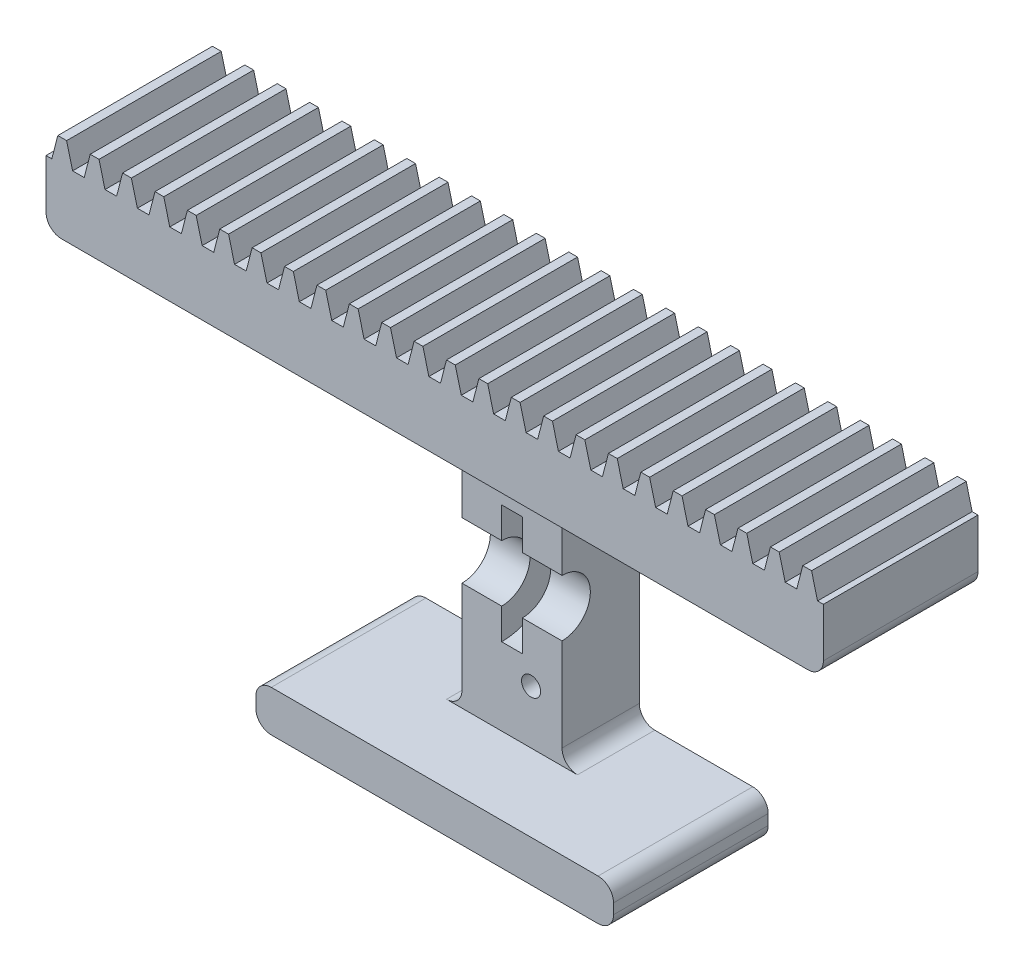
from build123d import *

# Parameters (mm, degrees)
RESSALTO_EXTRUS_O1_DEPTH          = 30
RESSALTO_EXTRUS_O2_DEPTH          = 30
ESBO_O3_W                         = 19.4
ESBO_O3_H                         = 3.2
CORTE_EXTRUS_O1_DEPTH             = 23.85
ESBO_O4_W                         = 5.4
ESBO_O4_H                         = 23.8
CORTE_EXTRUS_O2_DEPTH             = 26.5
ESBO_O5_W                         = 19.4
ESBO_O5_H                         = 53
CORTE_EXTRUS_O3_DEPTH             = 15.6
FILETE1_R                         = 5
ESBO_O6_W                         = 69.4
ESBO_O6_H                         = 15.6
CORTE_EXTRUS_O4_DEPTH             = 10
FILETE2_R                         = 3
RESSALTO_EXTRUS_O3_START          = 15.6
RESSALTO_EXTRUS_O3_DEPTH          = 15.6
ESBO_O8_R                         = 1.85
CORTE_EXTRUS_O5_DEPTH             = 165.173688513
CORTE_EXTRUS_O6_DEPTH             = 4
ESBO_O10_W                        = 14.4
ESBO_O10_H                        = 28.961678943
RESSALTO_EXTRUS_O4_DEPTH          = 19.4
RESSALTO_EXTRUS_O5_START          = 15.6
ESBO_O11_R                        = 1.85
RESSALTO_EXTRUS_O5_DEPTH          = 15.6
ESBO_O12_W                        = 35.911027454
ESBO_O12_H                        = 55
CORTE_EXTRUS_O7_DEPTH             = 15
CORTE_EXTRUS_O8_DEPTH             = 2
CORTE_EXTRUS_O8_DEPTH_BACK        = 2
ESBO_O13_R                        = 11.5
CORTE_EXTRUS_O9_REACH             = 104.733
ESBO_O14_R                        = 5.5
CORTE_EXTRUS_O9_DIRECTION_2_REACH = 104.733
CORTE_EXTRUS_O10_DEPTH            = 4


with BuildPart() as part:
    # Esboço1 → Ressalto-extrusão1 (new body)
    with BuildSketch(Plane.XY):
        Polygon((-148.507415706, 17), (-149.671194836, 12.5), (-150.8, 12.5), (-150.8, 0), (0, 0), (0, 12.5), (-1.125252364, 12.5), (-2.289031494, 17), (-3.994153806, 17), (-5.157932936, 12.5), (-7.408437664, 12.5), (-8.572216794, 17), (-10.277339106, 17), (-11.441118236, 12.5), (-13.691622964, 12.5), (-14.855402094, 17), (-16.560524406, 17), (-17.724303536, 12.5), (-19.974808264, 12.5), (-21.138587394, 17), (-22.843709706, 17), (-24.007488836, 12.5), (-26.257993564, 12.5), (-27.421772694, 17), (-29.126895006, 17), (-30.290674136, 12.5), (-32.541178864, 12.5), (-33.704957994, 17), (-35.410080306, 17), (-36.573859436, 12.5), (-38.824364164, 12.5), (-39.988143294, 17), (-41.693265606, 17), (-42.857044736, 12.5), (-45.107549464, 12.5), (-46.271328594, 17), (-47.976450906, 17), (-49.140230036, 12.5), (-51.390734764, 12.5), (-52.554513894, 17), (-54.259636206, 17), (-55.423415336, 12.5), (-57.673920064, 12.5), (-58.837699194, 17), (-60.542821506, 17), (-61.706600636, 12.5), (-63.957105364, 12.5), (-65.120884494, 17), (-66.826006806, 17), (-67.989785936, 12.5), (-70.240290664, 12.5), (-71.404069794, 17), (-73.109192106, 17), (-74.272971236, 12.5), (-76.523475964, 12.5), (-77.687255094, 17), (-79.392377406, 17), (-80.556156536, 12.5), (-82.806661264, 12.5), (-83.970440394, 17), (-85.675562706, 17), (-86.839341836, 12.5), (-89.089846564, 12.5), (-90.253625694, 17), (-91.958748006, 17), (-93.122527136, 12.5), (-95.373031864, 12.5), (-96.536810994, 17), (-98.241933306, 17), (-99.405712436, 12.5), (-101.656217164, 12.5), (-102.819996294, 17), (-104.525118606, 17), (-105.688897736, 12.5), (-107.939402464, 12.5), (-109.103181594, 17), (-110.808303906, 17), (-111.972083036, 12.5), (-114.222587764, 12.5), (-115.386366894, 17), (-117.091489206, 17), (-118.255268336, 12.5), (-120.505773064, 12.5), (-121.669552194, 17), (-123.374674506, 17), (-124.538453636, 12.5), (-126.788958364, 12.5), (-127.952737494, 17), (-129.657859806, 17), (-130.821638936, 12.5), (-133.072143664, 12.5), (-134.235922794, 17), (-135.941045106, 17), (-137.104824236, 12.5), (-139.355328964, 12.5), (-140.519108094, 17), (-142.224230406, 17), (-143.388009536, 12.5), (-145.638514264, 12.5), (-146.802293394, 17), align=None)
    extrude(amount=-RESSALTO_EXTRUS_O1_DEPTH)

    # Esboço2 → Ressalto-extrusão2 (add)
    with BuildSketch(Plane(origin=(0, 0, -30), x_dir=(-1, 0, 0), z_dir=(0, 0, -1))):
        Polygon((85.1, 0), (65.7, 0), (65.7, -55), (40.7, -55), (40.7, -63), (110.1, -63), (110.1, -55), (85.1, -55), align=None)
    extrude(amount=-RESSALTO_EXTRUS_O2_DEPTH)

    # Esboço3 → Corte-extrusão1 (cut)
    with BuildSketch(Plane.XY):
        with Locations((-75.4, -29)):
            Rectangle(ESBO_O3_W, ESBO_O3_H)
    extrude(amount=-CORTE_EXTRUS_O1_DEPTH, mode=Mode.SUBTRACT)

    # Esboço4 → Corte-extrusão2 (cut)
    with BuildSketch(Plane.XY):
        with Locations((-75.4, -29)):
            Rectangle(ESBO_O4_W, ESBO_O4_H)
    extrude(amount=-CORTE_EXTRUS_O2_DEPTH, mode=Mode.SUBTRACT)

    # Esboço5 → Corte-extrusão3 (cut)
    with BuildSketch(Plane.XY):
        with Locations((-75.4, -26.5)):
            Rectangle(ESBO_O5_W, ESBO_O5_H)
    extrude(amount=-CORTE_EXTRUS_O3_DEPTH, mode=Mode.SUBTRACT)

    # Filete1
    filete1_edges = [part.edges().sort_by_distance(p)[0] for p in [
        (-85.1, 0, -22.8),
        (-65.7, 0, -22.8),
    ]]
    fillet(filete1_edges, radius=FILETE1_R)

    # Esboço6 → Corte-extrusão4 (cut)
    with BuildSketch(Plane.XZ.offset(63)):
        with Locations((-75.4, -7.8)):
            Rectangle(ESBO_O6_W, ESBO_O6_H)
    extrude(amount=-CORTE_EXTRUS_O4_DEPTH, mode=Mode.SUBTRACT)

    # Filete2
    filete2_edges = [part.edges().sort_by_distance(p)[0] for p in [
        (0, 0, -15),
        (-150.8, 0, -15),
        (-85.1, -55, -22.8),
        (-110.1, -55, -22.8),
        (-110.1, -63, -22.8),
        (-40.7, -63, -22.8),
        (-40.7, -55, -22.8),
        (-65.7, -55, -22.8),
    ]]
    fillet(filete2_edges, radius=FILETE2_R)

    # Esboço7 → Ressalto-extrusão3 (add)
    with BuildSketch(Plane.XY.offset(-15.6).offset(RESSALTO_EXTRUS_O3_START)):
        with BuildLine():
            Line((-110.1, -58), (-110.1, -60))
            ThreePointArc((-110.1, -60), (-109.221320344, -62.121320344), (-107.1, -63))
            Line((-107.1, -63), (-43.7, -63))
            ThreePointArc((-43.7, -63), (-41.578679656, -62.121320344), (-40.7, -60))
            Line((-40.7, -60), (-40.7, -58))
            ThreePointArc((-40.7, -58), (-41.578679656, -55.878679656), (-43.7, -55))
            Line((-43.7, -55), (-62.7, -55))
            ThreePointArc((-62.7, -55), (-64.821320344, -54.121320344), (-65.7, -52))
            Line((-65.7, -52), (-65.7, -51.6))
            Line((-65.7, -51.6), (-85.1, -51.6))
            Line((-85.1, -51.6), (-85.1, -52))
            ThreePointArc((-85.1, -52), (-85.978679656, -54.121320344), (-88.1, -55))
            Line((-88.1, -55), (-107.1, -55))
            ThreePointArc((-107.1, -55), (-109.221320344, -55.878679656), (-110.1, -58))
        make_face()
    extrude(amount=-RESSALTO_EXTRUS_O3_DEPTH)

    # Esboço8 → Corte-extrusão5 (cut, through all)
    with BuildSketch(Plane.XY.offset(-15.6)):
        with Locations((-79.1, -8)):
            Circle(ESBO_O8_R)
        with Locations((-71.7, -44.6)):
            Circle(ESBO_O8_R)
    extrude(amount=-CORTE_EXTRUS_O5_DEPTH, mode=Mode.SUBTRACT)

    # Esboço9 → Corte-extrusão6 (cut)
    with BuildSketch(Plane(origin=(0, 0, -30), x_dir=(-1, 0, 0), z_dir=(0, 0, -1))):
        Polygon((79.1, -3.843078062), (75.5, -5.921539031), (75.5, -10.078460969), (79.1, -12.156921938), (82.7, -10.078460969), (82.7, -5.921539031), align=None)
        Polygon((71.7, -40.443078062), (68.1, -42.521539031), (68.1, -46.678460969), (71.7, -48.756921938), (75.3, -46.678460969), (75.3, -42.521539031), align=None)
    extrude(amount=-CORTE_EXTRUS_O6_DEPTH, mode=Mode.SUBTRACT)

    # Esboço10 → Ressalto-extrusão4 (add)
    with BuildSketch(Plane(origin=(-65.7, 0, 0), x_dir=(0, 0, -1), z_dir=(1, 0, 0))):
        with Locations((22.8, -27.2404917)):
            Rectangle(ESBO_O10_W, ESBO_O10_H)
    extrude(amount=-RESSALTO_EXTRUS_O4_DEPTH)

    # Esboço11 → Ressalto-extrusão5 (add)
    with BuildSketch(Plane.XY.offset(-15.6).offset(RESSALTO_EXTRUS_O5_START)):
        with BuildLine():
            Line((-90.1, 0), (-60.7, 0))
            ThreePointArc((-60.7, 0), (-64.235533906, -1.464466094), (-65.7, -5))
            Line((-65.7, -5), (-65.7, -51.6))
            Line((-65.7, -51.6), (-85.1, -51.6))
            Line((-85.1, -51.6), (-85.1, -5))
            ThreePointArc((-85.1, -5), (-86.564466094, -1.464466094), (-90.1, 0))
        make_face()
        with Locations((-79.1, -8)):
            Circle(ESBO_O11_R, mode=Mode.SUBTRACT)
        with Locations((-71.7, -44.6)):
            Circle(ESBO_O11_R, mode=Mode.SUBTRACT)
    extrude(amount=-RESSALTO_EXTRUS_O5_DEPTH)

    # Esboço12 → Corte-extrusão7 (cut)
    with BuildSketch(Plane.XY):
        with Locations((-72.144486273, -27.5)):
            Rectangle(ESBO_O12_W, ESBO_O12_H)
    extrude(amount=-CORTE_EXTRUS_O7_DEPTH, mode=Mode.SUBTRACT)

    # Esboço13 → Corte-extrusão8 (cut, two sides: drawn at the far end of the back side and taken through both)
    with BuildSketch(Plane(origin=(-75.4, 0, 0), x_dir=(0, 0, -1), z_dir=(1, 0, 0)).offset(-CORTE_EXTRUS_O8_DEPTH_BACK)):
        with Locations((15, -28.5)):
            Circle(ESBO_O13_R)
    extrude(amount=CORTE_EXTRUS_O8_DEPTH + CORTE_EXTRUS_O8_DEPTH_BACK, mode=Mode.SUBTRACT)

    # Esboço14 → Corte-extrusão9 (cut, up to next)
    with BuildSketch(Plane(origin=(-75.4, 0, 0), x_dir=(0, 0, -1), z_dir=(1, 0, 0)), mode=Mode.PRIVATE) as corte_extrus_o9_sk1:
        with Locations((15, -28.5)):
            Circle(ESBO_O14_R)
    corte_extrus_o9_tool1 = extrude(corte_extrus_o9_sk1.sketch, amount=-CORTE_EXTRUS_O9_REACH, mode=Mode.PRIVATE) & part.part
    add(corte_extrus_o9_tool1.solids().sort_by_distance((-75.4, -28.5, -15))[0], mode=Mode.SUBTRACT)

    # Esboço14 → Corte-extrusão9 direction 2 (cut, up to next)
    with BuildSketch(Plane(origin=(-75.4, 0, 0), x_dir=(0, 0, -1), z_dir=(1, 0, 0)), mode=Mode.PRIVATE) as corte_extrus_o9_direction_2_sk1:
        with Locations((15, -28.5)):
            Circle(ESBO_O14_R)
    corte_extrus_o9_direction_2_tool1 = extrude(corte_extrus_o9_direction_2_sk1.sketch, amount=CORTE_EXTRUS_O9_DIRECTION_2_REACH, mode=Mode.PRIVATE) & part.part
    add(corte_extrus_o9_direction_2_tool1.solids().sort_by_distance((-75.4, -28.5, -15))[0], mode=Mode.SUBTRACT)

    # Esboço15 → Corte-extrusão10 (cut)
    with BuildSketch(Plane(origin=(0, 0, -30), x_dir=(-1, 0, 0), z_dir=(0, 0, -1))):
        Polygon((69.486000671, -41.721331171), (71.7, -40.443078062), (73.913999329, -41.721331171), align=None)
    extrude(amount=-CORTE_EXTRUS_O10_DEPTH, mode=Mode.SUBTRACT)


solid = part.part
